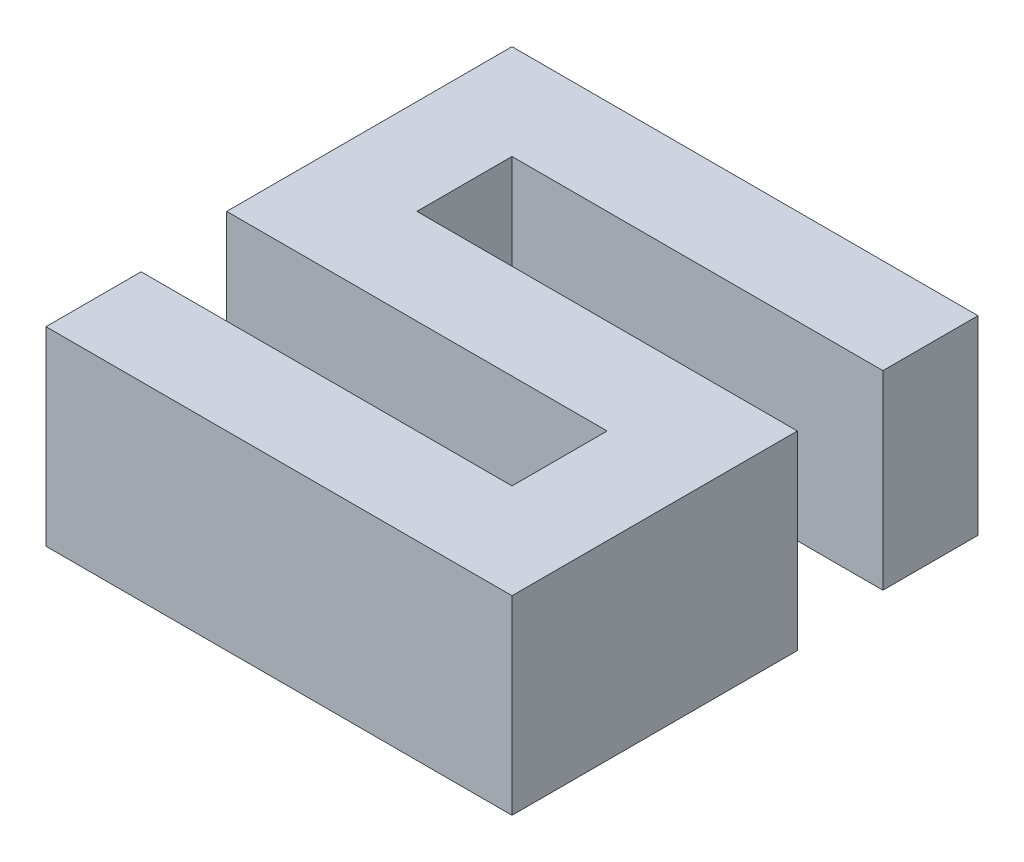
from build123d import *

# Parameters (mm, degrees)
EXTRUDE_THIN1_DEPTH = 50


with BuildPart() as part:
    # Sketch2 → Extrude-Thin1 (new body)
    with BuildSketch(Plane(origin=(0, 0, 0), x_dir=(1, 0, 0), z_dir=(0, 1, 0))):
        Polygon((52.065491184, 62.5), (-70.434508816, 62.5), (-70.434508816, -12.5), (29.565491184, -12.5), (29.565491184, -37.5), (-67.934508816, -37.5), (-67.934508816, -62.5), (54.565491184, -62.5), (54.565491184, 12.5), (-45.434508816, 12.5), (-45.434508816, 37.5), (52.065491184, 37.5), align=None)
    extrude(amount=EXTRUDE_THIN1_DEPTH)


solid = part.part
